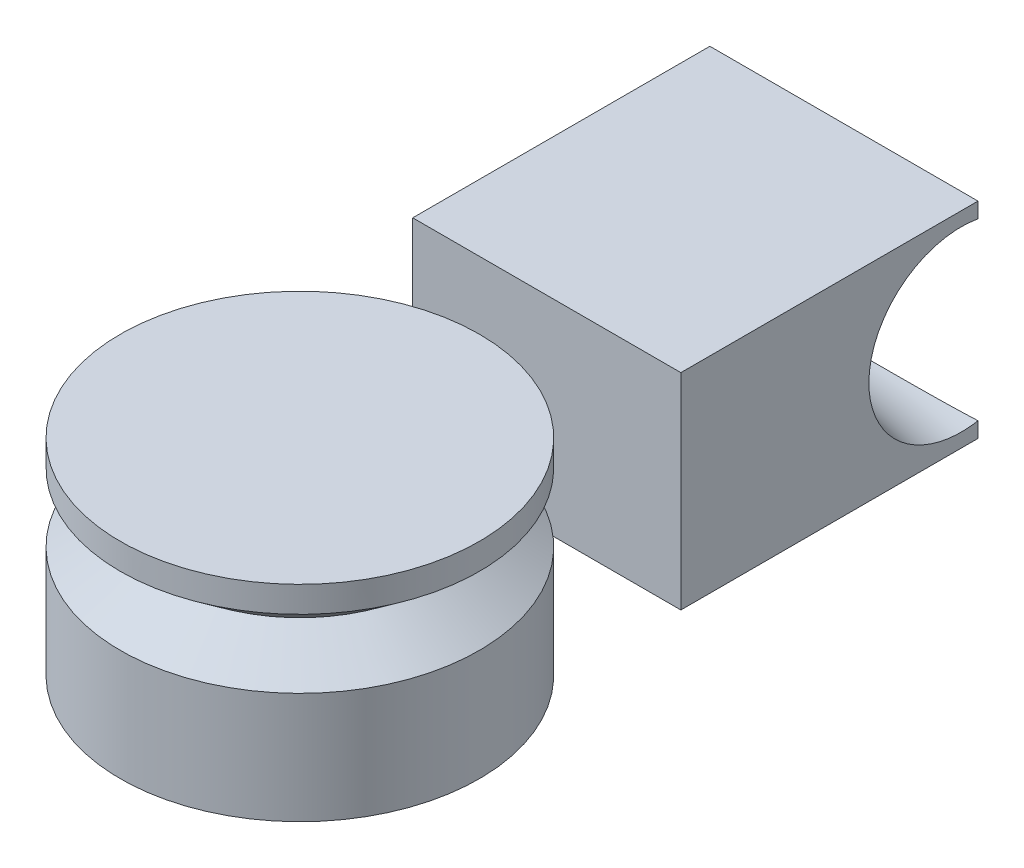
from build123d import *

# Parameters (mm, degrees)
SKETCH1_W           = 58.68704402
SKETCH1_H           = 67.209255033
SKETCH2_W           = 87.660679444
SKETCH2_H           = 97.137509655
BOSS_EXTRUDE1_DEPTH = 67.209255033
SKETCH3_R           = 29.07089472


with BuildPart() as part:
    # Sketch1 → Revolve1 (revolve)
    with BuildSketch(Plane.XY, mode=Mode.PRIVATE) as revolve1_sk:
        with Locations((29.34352201, 33.604627517)):
            Rectangle(SKETCH1_W, SKETCH1_H)
    revolve(revolve1_sk.sketch.rotate(Axis((0, 0, 0), (0, 1, 0)), 90), axis=Axis((0, 0, 0), (0, 1, 0)))


with BuildPart() as body_2:
    # Sketch2 → Boss-Extrude1 (new body)
    with BuildSketch(Plane(origin=(0, 0, 0), x_dir=(1, 0, 0), z_dir=(0, 1, 0))):
        with Locations((0, 129.298002943)):
            Rectangle(SKETCH2_W, SKETCH2_H)
    extrude(amount=BOSS_EXTRUDE1_DEPTH)


with BuildPart() as cut_revolve1_tool:
    # Sketch3 → Cut-Revolve1 (revolve)
    with BuildSketch(Plane(origin=(0, 0, 0), x_dir=(0, 0, -1), z_dir=(1, 0, 0))):
        with Locations((177.86675777, 33.604627516)):
            Circle(SKETCH3_R)
        Polygon((62.846148494, 61.906953495), (43.003189321, 46.65920592), (62.846148494, 33.604627516), align=None)
    revolve(axis=Axis((0, 0, 0), (0, -1, 0)))


with BuildPart() as part_1:
    add(part.part)

    # Cut-Revolve1: cut by cut_revolve1_tool
    add(cut_revolve1_tool.part, mode=Mode.SUBTRACT)


with BuildPart() as body_2_1:
    add(body_2.part)

    # Cut-Revolve1: cut by cut_revolve1_tool
    add(cut_revolve1_tool.part, mode=Mode.SUBTRACT)


solid = Compound([part_1.part, body_2_1.part])
